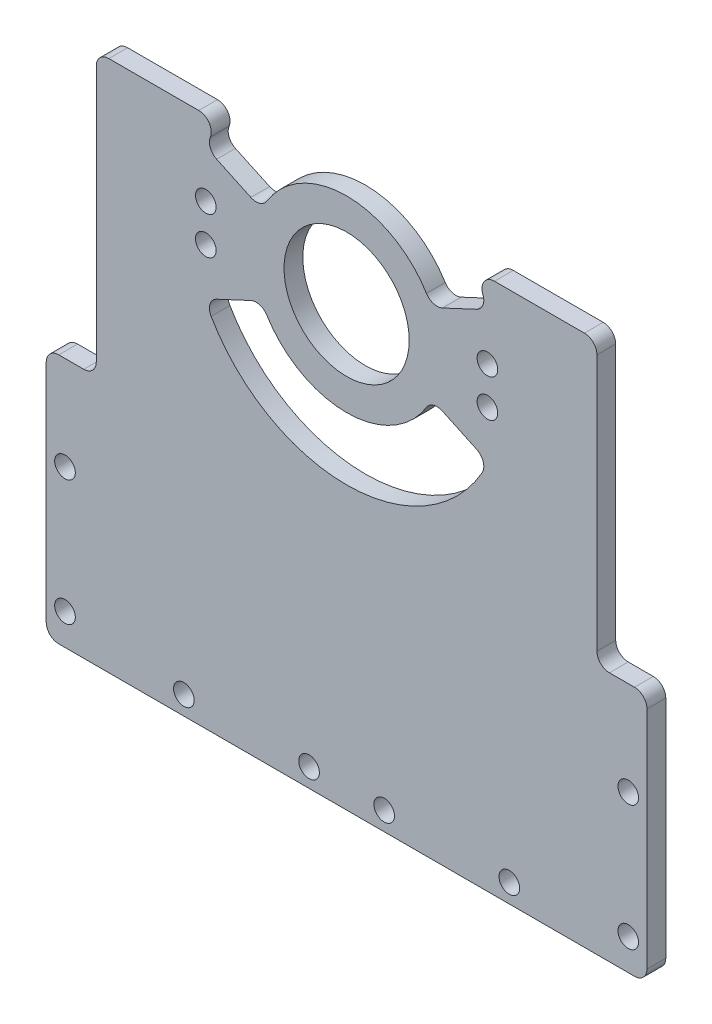
from build123d import *

# Parameters (mm, degrees)
SKETCH_1_W          = 80
SKETCH_1_H          = 85
SKETCH_1_R          = 10
SKETCH_1_R_2        = 1.65
EXTRUDE_1_DEPTH     = 3
CUT_EXTRUDE_1_DEPTH = 59.440140315
SKETCH_3_W          = 8
SKETCH_3_H          = 40
EXTRUDE_2_DEPTH     = 3
SKETCH_4_R          = 1.65
CUT_EXTRUDE_2_DEPTH = 65.181383594
FILLET_1_R          = 2
FILLET_2_R          = 2


with BuildPart() as part:
    # 草图1 → 凸台-拉伸1 (new body)
    with BuildSketch(Plane.XY):
        Rectangle(SKETCH_1_W, SKETCH_1_H)
        with Locations((0, 27.5)):
            Circle(SKETCH_1_R, mode=Mode.SUBTRACT)
        with Locations((-6, -39.5)):
            Circle(SKETCH_1_R_2, mode=Mode.SUBTRACT)
        with Locations((-26, -39.5)):
            Circle(SKETCH_1_R_2, mode=Mode.SUBTRACT)
        with Locations(Location((26, -39.5, 0), (0, 0, 180))):
            Circle(SKETCH_1_R_2, mode=Mode.SUBTRACT)
        with Locations(Location((6, -39.5, 0), (0, 0, 180))):
            Circle(SKETCH_1_R_2, mode=Mode.SUBTRACT)
        with Locations((-22.5, 30.5)):
            Circle(SKETCH_1_R_2, mode=Mode.SUBTRACT)
        with Locations(Location((-22.5, 24.5, 0), (0, 0, 180))):
            Circle(SKETCH_1_R_2, mode=Mode.SUBTRACT)
        with Locations(Location((22.5, 30.5, 0), (0, 0, 180))):
            Circle(SKETCH_1_R_2, mode=Mode.SUBTRACT)
        with Locations((22.5, 24.5)):
            Circle(SKETCH_1_R_2, mode=Mode.SUBTRACT)
    extrude(amount=EXTRUDE_1_DEPTH)

    # 草图2 → 切除-拉伸1 (cut, through all)
    with BuildSketch(Plane.XY.offset(3)):
        with BuildLine():
            Line((22.657694676, 16.934543456), (13.594616806, 21.160726074))
            ThreePointArc((13.594616806, 21.160726074), (0, 12.5), (-13.594616806, 21.160726074))
            Line((-13.594616806, 21.160726074), (-22.657694676, 16.934543456))
            ThreePointArc((-22.657694676, 16.934543456), (0, 2.5), (22.657694676, 16.934543456))
        make_face()
        with BuildLine():
            Line((-22.657694676, 38.065456544), (-13.594616806, 33.839273926))
            ThreePointArc((-13.594616806, 33.839273926), (0, 42.5), (13.594616806, 33.839273926))
            Line((13.594616806, 33.839273926), (22.657694676, 38.065456544))
            ThreePointArc((22.657694676, 38.065456544), (0, 52.5), (-22.657694676, 38.065456544))
        make_face()
    extrude(amount=-CUT_EXTRUDE_1_DEPTH, mode=Mode.SUBTRACT)

    # 草图3 → 凸台-拉伸2 (add)
    with BuildSketch(Plane.XY.offset(3)):
        with Locations((44, -22.5)):
            Rectangle(SKETCH_3_W, SKETCH_3_H)
        with Locations((-44, -22.5)):
            Rectangle(SKETCH_3_W, SKETCH_3_H)
    extrude(amount=-EXTRUDE_2_DEPTH)

    # 草图4 → 切除-拉伸2 (cut, through all)
    with BuildSketch(Plane.XY.offset(3)):
        with Locations((45, -37.5)):
            Circle(SKETCH_4_R)
        with Locations((45, -17.5)):
            Circle(SKETCH_4_R)
        with Locations(Location((-45, -17.5, 0), (0, 0, 180))):
            Circle(SKETCH_4_R)
        with Locations(Location((-45, -37.5, 0), (0, 0, 180))):
            Circle(SKETCH_4_R)
    extrude(amount=-CUT_EXTRUDE_2_DEPTH, mode=Mode.SUBTRACT)

    # 圆角1
    fillet_1_edges = [part.edges().sort_by_distance(p)[0] for p in [
        (-48, -2.5, 1.5),
        (-13.594616806, 21.160726074, 1.5),
        (13.594616806, 21.160726074, 1.5),
        (22.657694676, 16.934543456, 1.5),
        (-22.657694676, 16.934543456, 1.5),
        (-22.657694676, 38.065456544, 1.5),
        (13.594616806, 33.839273926, 1.5),
        (22.657694676, 38.065456544, 1.5),
        (-13.594616806, 33.839273926, 1.5),
        (-40, 42.5, 1.5),
        (40, -2.5, 1.5),
        (48, -2.5, 1.5),
    ]]
    fillet(fillet_1_edges, radius=FILLET_1_R)

    # 圆角2
    fillet_2_edges = [part.edges().sort_by_distance(p)[0] for p in [
        (20, 42.5, 1.5),
        (-20, 42.5, 1.5),
        (40, 42.5, 1.5),
        (-48, -42.5, 1.5),
        (48, -42.5, 1.5),
        (-40, -2.5, 1.5),
    ]]
    fillet(fillet_2_edges, radius=FILLET_2_R)


solid = part.part
